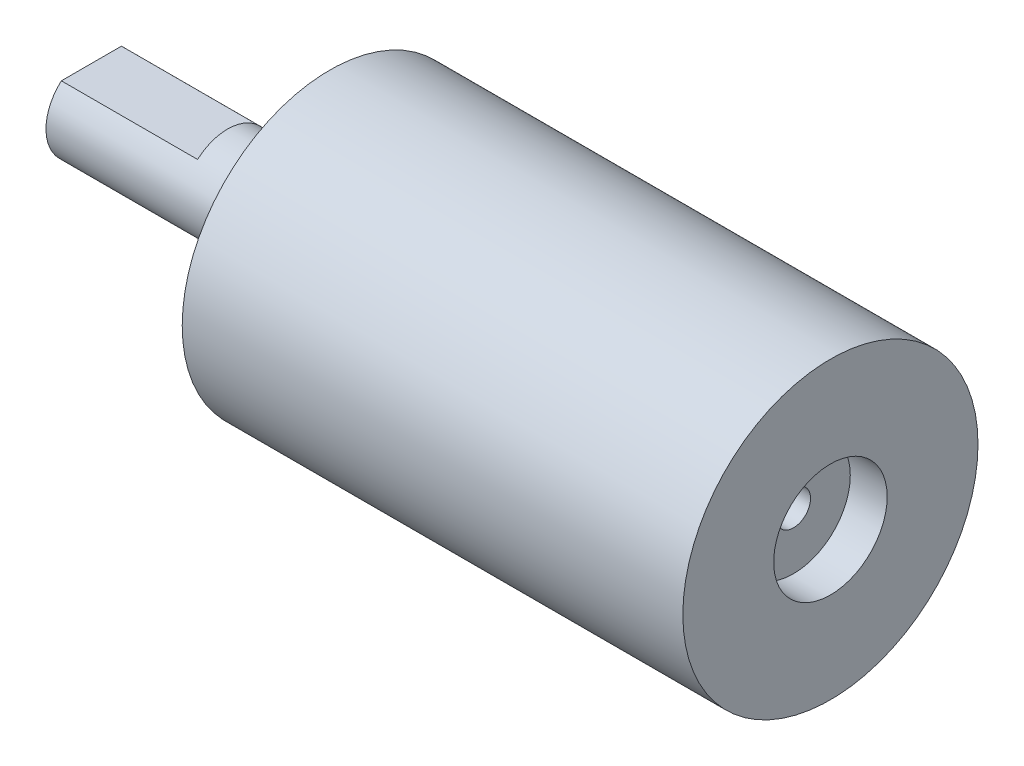
from build123d import *

# Parameters (mm, degrees)
SZKIC2_R                   = 1
WYTNIJ_WYCI_GNI_CIE1_DEPTH = 3.6
WYTNIJ_WYCI_GNI_CIE2_START = -12
WYTNIJ_WYCI_GNI_CIE2_DEPTH = 12


with BuildPart() as part:
    # Szkic1 → Obrót1 (revolve)
    with BuildSketch(Plane.XY, mode=Mode.PRIVATE) as obr_t1_sk:
        Polygon((0, 0), (0, 4), (19, 4), (19, 9.5), (21, 9.5), (21, 13), (65.1, 13), (65.1, 5), (61.85, 5), (61.85, 1.5), (54.1, 1.5), (54.1, 0), align=None)
    revolve(obr_t1_sk.sketch.rotate(Axis((0, 0, 0), (-1, 0, 0)), 90), axis=Axis((0, 0, 0), (-1, 0, 0)))

    # Szkic2 → Wytnij-wyciągnięcie1 (cut)
    with BuildSketch(Plane.ZY.offset(-21)):
        with Locations((0, 11.25)):
            Circle(SZKIC2_R)
        with Locations((9.742785793, 5.625)):
            Circle(SZKIC2_R)
        with Locations((9.742785793, -5.625)):
            Circle(SZKIC2_R)
        with Locations((0, -11.25)):
            Circle(SZKIC2_R)
        with Locations((-9.742785793, -5.625)):
            Circle(SZKIC2_R)
        with Locations((-9.742785793, 5.625)):
            Circle(SZKIC2_R)
    extrude(amount=-WYTNIJ_WYCI_GNI_CIE1_DEPTH, mode=Mode.SUBTRACT)

    # Szkic3 → Wytnij-wyciągnięcie2 (cut)
    with BuildSketch(Plane.ZY.offset(WYTNIJ_WYCI_GNI_CIE2_START)):
        with BuildLine():
            Line((-2.645751311, 3), (2.645751311, 3))
            ThreePointArc((2.645751311, 3), (0, 4), (-2.645751311, 3))
        make_face()
    extrude(amount=WYTNIJ_WYCI_GNI_CIE2_DEPTH, mode=Mode.SUBTRACT)


solid = part.part
